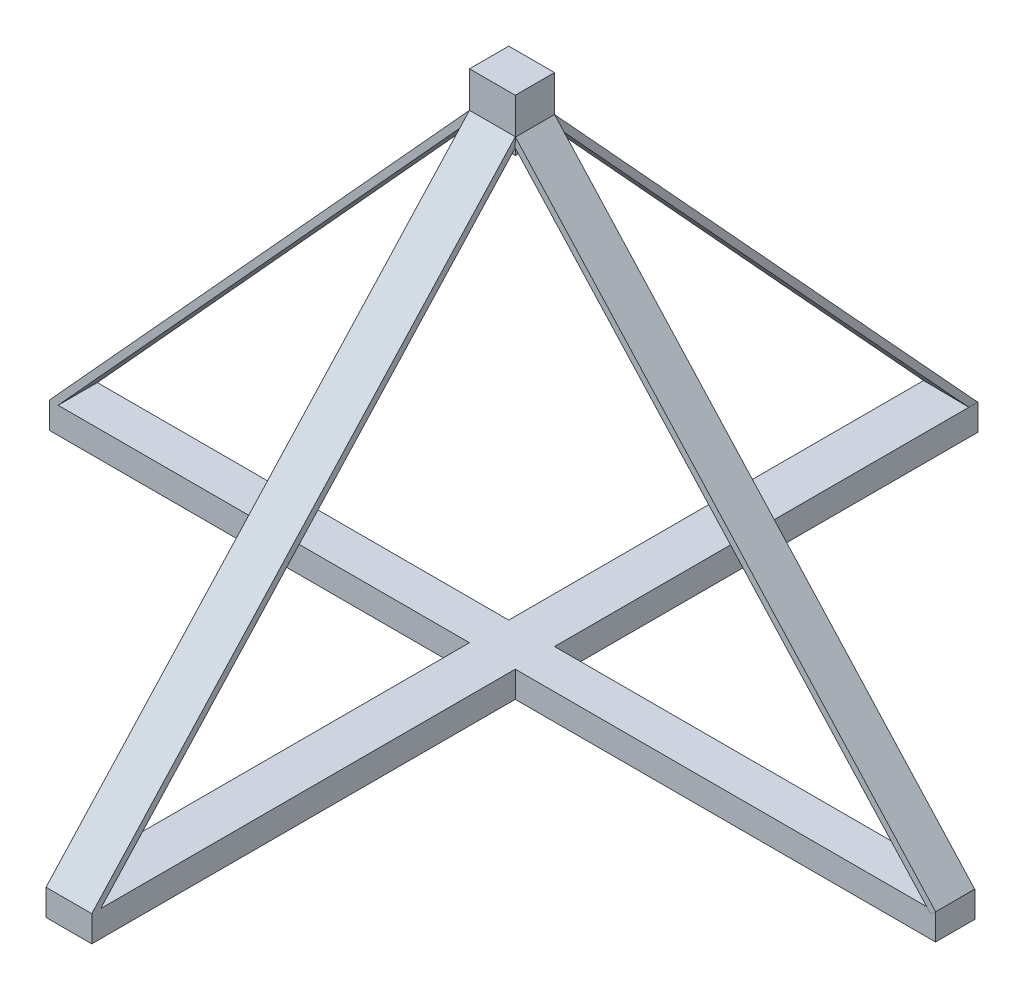
from build123d import *

# Parameters (mm, degrees)
SKETCH1_W           = 88.9
SKETCH1_H           = 1720.85
SKETCH1_W_2         = 815.975
SKETCH1_H_2         = 76.2
SKETCH1_W_3         = 816.102
BOSS_EXTRUDE1_DEPTH = 50.8
SKETCH2_W           = 88.9
SKETCH2_H           = 76.2
BOSS_EXTRUDE2_DEPTH = 101.6
SKETCH11_W          = 76.200000018
SKETCH11_H          = 1210.925919092
BOSS_EXTRUDE6_DEPTH = 12.7
SKETCH12_W          = 88.9
SKETCH12_H          = 1215.673478613
BOSS_EXTRUDE7_DEPTH = 12.7
SKETCH13_W          = 76.2
SKETCH13_H          = 1211.38713944
BOSS_EXTRUDE8_DEPTH = 12.7
BOSS_EXTRUDE9_DEPTH = 12.7


with BuildPart() as part:
    # Sketch1 → Boss-Extrude1 (new body)
    with BuildSketch(Plane(origin=(0, 0, 0), x_dir=(1, 0, 0), z_dir=(0, 1, 0))):
        with Locations((44.45, -860.425)):
            Rectangle(SKETCH1_W, SKETCH1_H)
        with Locations((-407.9875, -860.425)):
            Rectangle(SKETCH1_W_2, SKETCH1_H_2)
        with Locations((496.951, -860.425)):
            Rectangle(SKETCH1_W_3, SKETCH1_H_2)
    extrude(amount=BOSS_EXTRUDE1_DEPTH)



with BuildPart() as body_2:
    # Sketch2 → Boss-Extrude2 (new body)
    with BuildSketch(Plane(origin=(0, 914.4, 0), x_dir=(1, 0, 0), z_dir=(0, 1, 0))):
        with Locations((44.45, -860.425)):
            Rectangle(SKETCH2_W, SKETCH2_H)
    extrude(amount=BOSS_EXTRUDE2_DEPTH)


with BuildPart() as part_1:
    add(part.part)

    add(body_2.part)  # Boss-Extrude6 merges body 2
    # Sketch11 → Boss-Extrude6 (add)
    with BuildSketch(Plane(origin=(515.239820979, 469.832103155, -4.562218888), x_dir=(0.004834466277190451, 0.004408408213341139, 0.9999785967073692), z_dir=(-0.7389010285363795, -0.6737822080618631, 0.006542639158684001))):
        with Locations((865.004917385, 33.212637894)):
            Rectangle(SKETCH11_W, SKETCH11_H)
    extrude(amount=BOSS_EXTRUDE6_DEPTH)

    # Sketch12 → Boss-Extrude7 (add)
    with BuildSketch(Plane(origin=(0, 880.564980502, 958.757073848), x_dir=(-1, 0, 0), z_dir=(0, -0.6764357489630263, -0.7365016480122972))):
        with Locations((-44.45, -518.793435578)):
            Rectangle(SKETCH12_W, SKETCH12_H)
    extrude(amount=BOSS_EXTRUDE7_DEPTH)

    # Sketch13 → Boss-Extrude8 (add)
    with BuildSketch(Plane(origin=(-471.041897908, 429.285012176, 0), x_dir=(0, 0, 1), z_dir=(-0.7391076653302462, 0.6735873061824078, 0))):
        with Locations((860.425, 93.609836957)):
            Rectangle(SKETCH13_W, SKETCH13_H)
    extrude(amount=-BOSS_EXTRUDE8_DEPTH)

    # Sketch14 → Boss-Extrude9 (add)
    with BuildSketch(Plane(origin=(0.320485024, 23.523248222, -25.60821453), x_dir=(-0.9999575295340857, 0.006234703363140706, -0.006787311843563117), z_dir=(0.009216242623115463, 0.6764620710773515, -0.7364198036892085))):
        Polygon((-88.579501445, 37.41171492), (0.316722931, 37.41171492), (0.316722931, 1252.792330393), (-88.579501445, 1252.540281398), align=None)
    extrude(amount=-BOSS_EXTRUDE9_DEPTH)


solid = part_1.part
